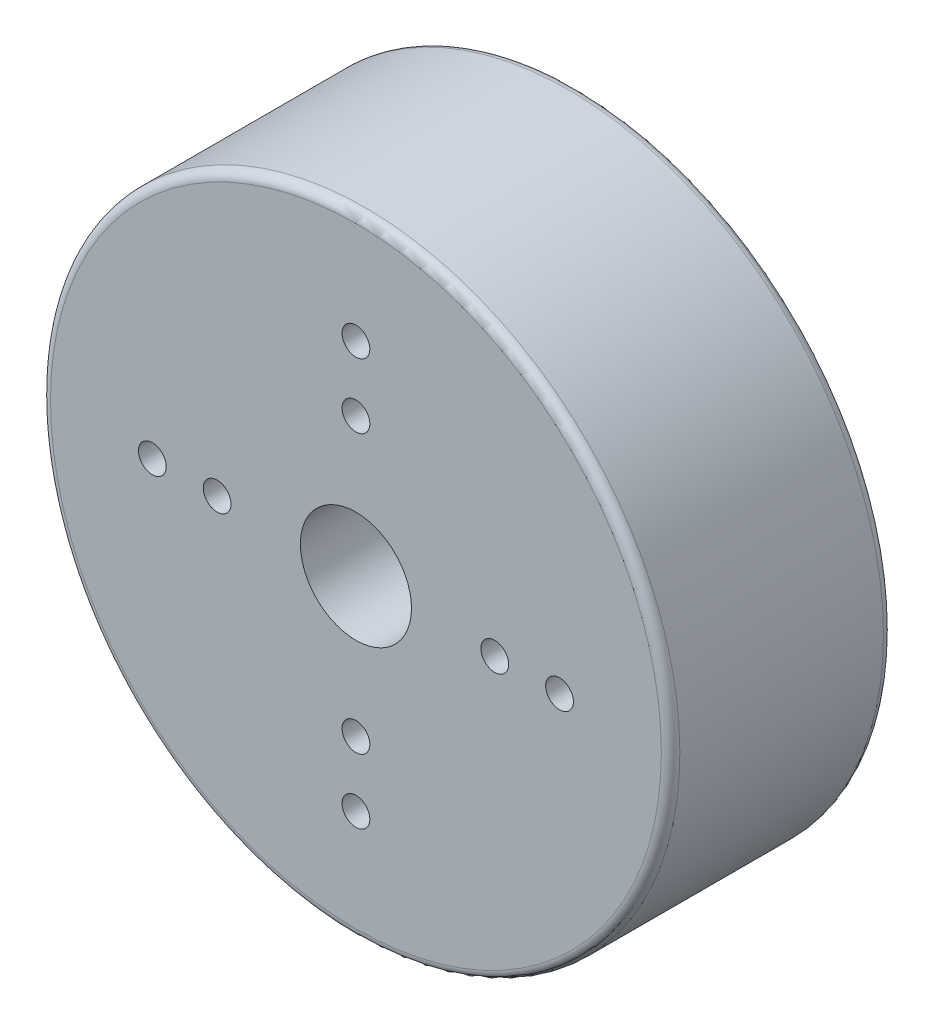
from build123d import *

# Parameters (mm, degrees)
SKETCH_1_R          = 34
EXTRUDE_1_DEPTH     = 24
SKETCH_2_R          = 7
EXTRUDE_2_DEPTH     = 1.1
SKETCH_3_R          = 6
CUT_EXTRUDE_1_DEPTH = 28.1
SKETCH_4_R          = 1.5
CUT_EXTRUDE_2_DEPTH = 28.1
FILLET_2_R          = 1
FILLET_3_R          = 1


with BuildPart() as part:
    # 草图1 → 凸台-拉伸1 (new body)
    with BuildSketch(Plane.XY):
        Circle(SKETCH_1_R)
    extrude(amount=EXTRUDE_1_DEPTH)

    # 草图2 → 凸台-拉伸2 (add)
    with BuildSketch(Plane(origin=(0, 0, 0), x_dir=(-1, 0, 0), z_dir=(0, 0, -1))):
        Circle(SKETCH_2_R)
    extrude(amount=EXTRUDE_2_DEPTH)

    # 草图3 → 切除-拉伸1 (cut)
    with BuildSketch(Plane(origin=(0, 0, -1.1), x_dir=(-1, 0, 0), z_dir=(0, 0, -1))):
        Circle(SKETCH_3_R)
    extrude(amount=-CUT_EXTRUDE_1_DEPTH, mode=Mode.SUBTRACT)

    # 草图4 → 切除-拉伸2 (cut)
    with BuildSketch(Plane.XY.offset(24)):
        with Locations((0, 22)):
            Circle(SKETCH_4_R)
        with Locations((0, -22)):
            Circle(SKETCH_4_R)
        with Locations((-22, 0)):
            Circle(SKETCH_4_R)
        with Locations((22, 0)):
            Circle(SKETCH_4_R)
        with Locations((0, 15)):
            Circle(SKETCH_4_R)
        with Locations((-15, 0)):
            Circle(SKETCH_4_R)
        with Locations((15, 0)):
            Circle(SKETCH_4_R)
        with Locations((0, -15)):
            Circle(SKETCH_4_R)
    extrude(amount=-CUT_EXTRUDE_2_DEPTH, mode=Mode.SUBTRACT)

    # 圆角2
    fillet_2_edges = [part.edges().sort_by_distance(p)[0] for p in [
        (-34, 0, 0),
    ]]
    fillet(fillet_2_edges, radius=FILLET_2_R)

    # 圆角3
    fillet_3_edges = [part.edges().sort_by_distance(p)[0] for p in [
        (-34, 0, 24),
    ]]
    fillet(fillet_3_edges, radius=FILLET_3_R)


solid = part.part
